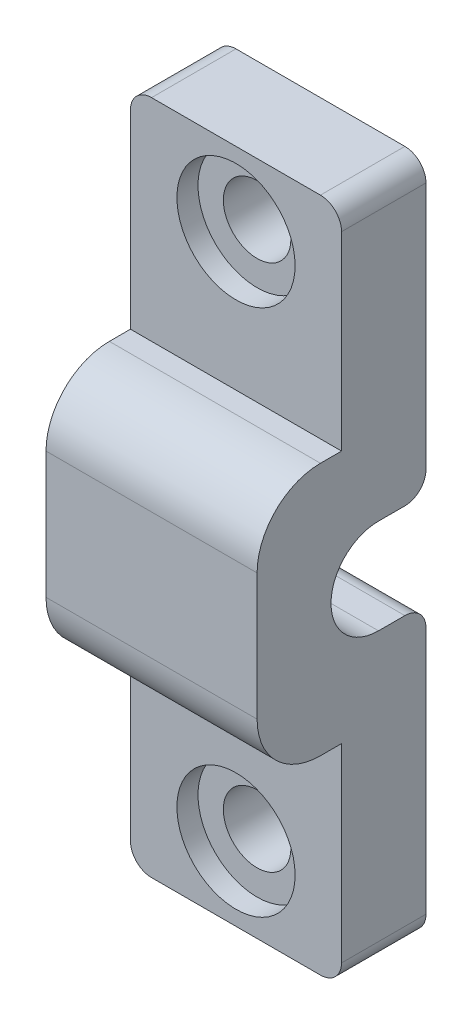
from build123d import *

# Parameters (mm, degrees)
CROQUIS1_W              = 10
CROQUIS1_H              = 32
SALIENTE_EXTRUIR1_DEPTH = 8
CROQUIS2_R              = 1.6
CORTAR_EXTRUIR1_DEPTH   = 8
CROQUIS3_R              = 2.25
CORTAR_EXTRUIR2_DEPTH   = 10
REDONDEO1_R             = 1
CORTAR_EXTRUIR3_START   = -10
CROQUIS4_W              = 4
CROQUIS4_H              = 10
CORTAR_EXTRUIR3_DEPTH   = 10
REDONDEO2_R             = 3
REDONDEO3_R             = 1
CROQUIS5_R              = 2.8
CORTAR_EXTRUIR4_DEPTH   = 1


with BuildPart() as part:
    # Croquis1 → Saliente-Extruir1 (new body)
    with BuildSketch(Plane.XY):
        with Locations((5, 16)):
            Rectangle(CROQUIS1_W, CROQUIS1_H)
    extrude(amount=SALIENTE_EXTRUIR1_DEPTH)

    # Croquis2 → Cortar-Extruir1 (cut)
    with BuildSketch(Plane.XY.offset(8)):
        with Locations((5, 28.5)):
            Circle(CROQUIS2_R)
        with Locations((5, 3.5)):
            Circle(CROQUIS2_R)
    extrude(amount=-CORTAR_EXTRUIR1_DEPTH, mode=Mode.SUBTRACT)

    # Croquis3 → Cortar-Extruir2 (cut)
    with BuildSketch(Plane.ZY):
        with Locations((2.25, 16)):
            Circle(CROQUIS3_R)
        with BuildLine():
            ThreePointArc((0, 16.000000003), (0.659009743, 17.590990259), (2.25, 18.25))
            Line((2.25, 18.25), (0, 18.25))
            Line((0, 18.25), (0, 16.000000003))
        make_face()
        with BuildLine():
            ThreePointArc((2.25, 13.75), (0.659009741, 14.409009743), (0, 16.000000003))
            Line((0, 16.000000003), (0, 13.75))
            Line((0, 13.75), (2.25, 13.75))
        make_face()
    extrude(amount=-CORTAR_EXTRUIR2_DEPTH, mode=Mode.SUBTRACT)

    # Redondeo1
    redondeo1_edges = [part.edges().sort_by_distance(p)[0] for p in [
        (5, 13.75, 0),
        (5, 18.25, 0),
    ]]
    fillet(redondeo1_edges, radius=REDONDEO1_R)

    # Croquis4 → Cortar-Extruir3 (cut)
    with BuildSketch(Plane.ZY.offset(CORTAR_EXTRUIR3_START)):
        with Locations((6, 27)):
            Rectangle(CROQUIS4_W, CROQUIS4_H)
        with Locations((6, 5)):
            Rectangle(CROQUIS4_W, CROQUIS4_H)
    extrude(amount=CORTAR_EXTRUIR3_DEPTH, mode=Mode.SUBTRACT)

    # Redondeo2
    redondeo2_edges = [part.edges().sort_by_distance(p)[0] for p in [
        (5, 22, 8),
        (5, 10, 8),
    ]]
    fillet(redondeo2_edges, radius=REDONDEO2_R)

    # Redondeo3
    redondeo3_edges = [part.edges().sort_by_distance(p)[0] for p in [
        (0, 32, 2),
        (10, 32, 2),
        (10, 0, 2),
        (0, 0, 2),
    ]]
    fillet(redondeo3_edges, radius=REDONDEO3_R)

    # Croquis5 → Cortar-Extruir4 (cut)
    with BuildSketch(Plane.XY.offset(4)):
        with Locations((5, 28.5)):
            Circle(CROQUIS5_R)
        with Locations((5, 3.5)):
            Circle(CROQUIS5_R)
    extrude(amount=-CORTAR_EXTRUIR4_DEPTH, mode=Mode.SUBTRACT)


solid = part.part
